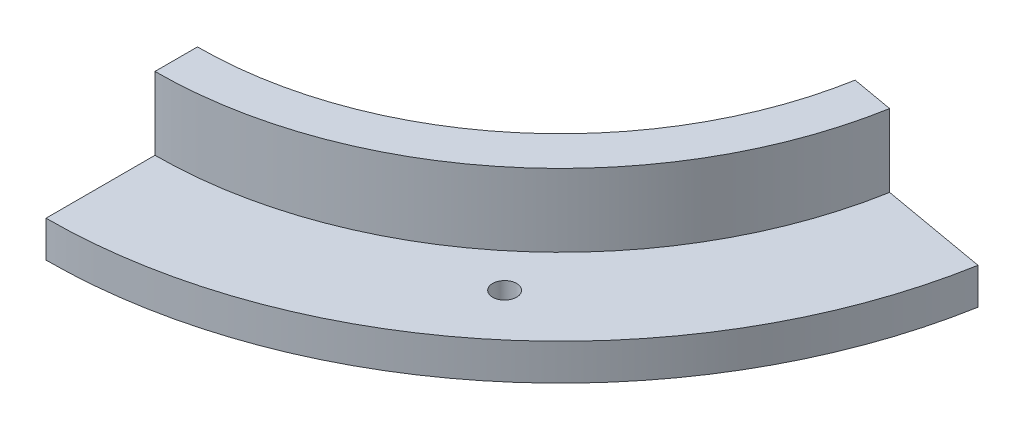
from build123d import *

# Parameters (mm, degrees)
ESTRUSIONE_ESTRUSIONE1_DEPTH = 20
ESTRUSIONE_ESTRUSIONE2_DEPTH = 10
SCHIZZO4_R                   = 2.8
TAGLIO_ESTRUSIONE2_DEPTH     = 2.8
TAGLIO_ESTRUSIONE3_START     = -20
TAGLIO_ESTRUSIONE3_DEPTH     = 20
FORO_PER_VITE_M6_1_D         = 6.6


with BuildPart() as part:
    # Schizzo1 → Estrusione-Estrusione1 (new body)
    with BuildSketch(Plane(origin=(0, 0, 0), x_dir=(1, 0, 0), z_dir=(0, 1, 0))):
        with BuildLine():
            Line((0, -91.7), (0, -141.7))
            ThreePointArc((0, -141.7), (91.083004293, -108.54849759), (139.547258602, -24.605946775))
            Line((139.547258602, -24.605946775), (90.306870951, -15.923537892))
            ThreePointArc((90.306870951, -15.923537892), (81.799772383, -41.444990506), (66.252536018, -63.399459549))
            Line((66.252536018, -63.399459549), (50.931647156, -76.255211743))
            ThreePointArc((50.931647156, -76.255211743), (26.610966566, -87.753897112), (0, -91.7))
        make_face()
    extrude(amount=ESTRUSIONE_ESTRUSIONE1_DEPTH)

    # Schizzo2 → Estrusione-Estrusione2 (add)
    with BuildSketch(Plane(origin=(0, 20, 0), x_dir=(1, 0, 0), z_dir=(0, 1, 0))):
        with BuildLine():
            Line((0, -100), (0, -141.7))
            ThreePointArc((0, -141.7), (91.083004293, -108.54849759), (139.547258602, -24.605946775))
            Line((139.547258602, -24.605946775), (98.480775301, -17.364817767))
            ThreePointArc((98.480775301, -17.364817767), (64.278760969, -76.604444312), (0, -100))
        make_face()
    extrude(amount=ESTRUSIONE_ESTRUSIONE2_DEPTH)

    # Schizzo4 → Taglio-Estrusione2 (cut)
    with BuildSketch(Plane(origin=(58.592091587, 0, 69.827335646), x_dir=(-0.7660444431189816, 0, 0.6427876096865353), z_dir=(-0.6427876096865353, 0, -0.7660444431189817))):
        with Locations((0, 10)):
            Circle(SCHIZZO4_R)
    extrude(amount=-TAGLIO_ESTRUSIONE2_DEPTH, mode=Mode.SUBTRACT)

    # Schizzo5 → Taglio-Estrusione3 (cut)
    with BuildSketch(Plane(origin=(0, 30, 0), x_dir=(1, 0, 0), z_dir=(0, 1, 0)).offset(TAGLIO_ESTRUSIONE3_START)):
        with BuildLine():
            Line((0, -141.7), (0, -111.7))
            ThreePointArc((0, -111.7), (71.799376002, -85.567164296), (110.003026011, -19.396501445))
            Line((110.003026011, -19.396501445), (139.547258602, -24.605946775))
            ThreePointArc((139.547258602, -24.605946775), (91.083004293, -108.54849759), (0, -141.7))
        make_face()
    extrude(amount=TAGLIO_ESTRUSIONE3_DEPTH, mode=Mode.SUBTRACT)

    # Foro per Vite M6-1 (through all)
    with Locations(Plane(origin=(80.348451211, 10, 95.75555539), x_dir=(0, 0, 1), z_dir=(0, 1, 0))):
        with Locations((0, 0)):
            Hole(FORO_PER_VITE_M6_1_D / 2)


solid = part.part
